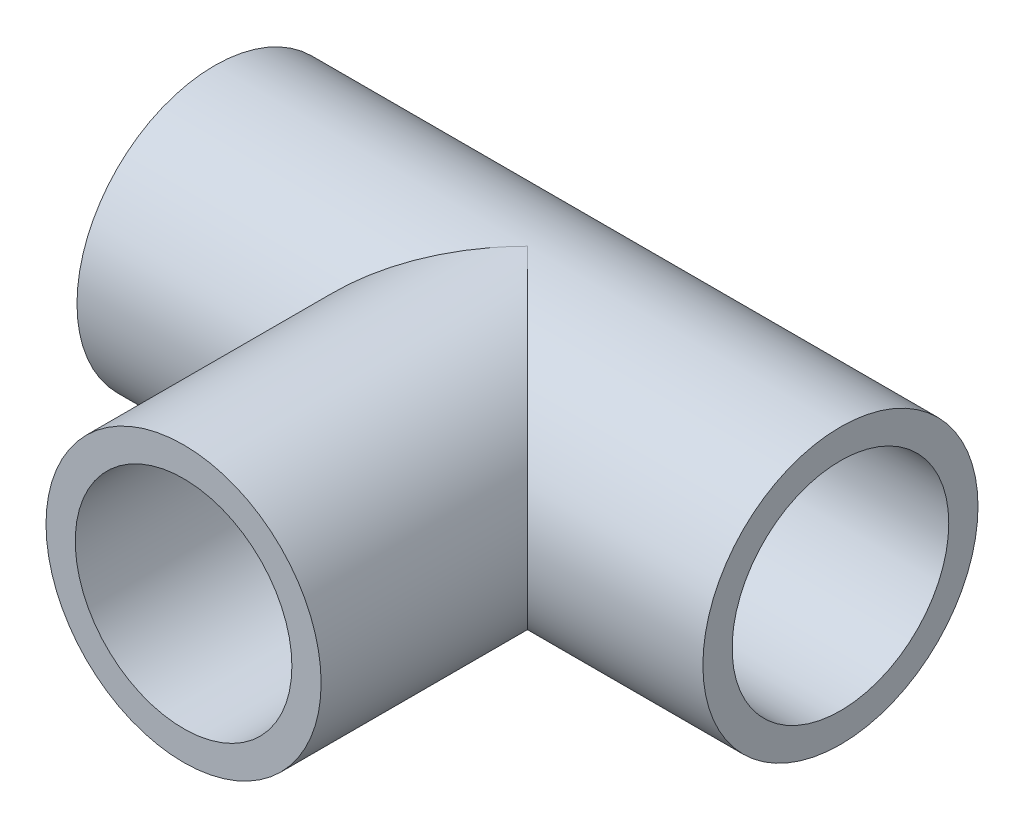
from build123d import *
from build123d.topology import SkipClean

# Parameters (mm, degrees)
SKETCH1_R               = 10.16
SKETCH1_R_2             = 6.35
BOSS_EXTRUDE2_DEPTH     = 20.828
SKETCH8_R               = 10.16
SKETCH8_R_2             = 6.35
BOSS_EXTRUDE5_DEPTH     = 12.7
BOSS_EXTRUDE6_START     = 12.7
SKETCH2_R               = 10.16
SKETCH2_R_2             = 8.001
BOSS_EXTRUDE6_DEPTH     = 12.7
SKETCH3_R               = 10.16
SKETCH3_R_2             = 8.001
BOSS_EXTRUDE7_DEPTH     = 12.7
SKETCH9_R               = 10.16
SKETCH9_R_2             = 8.001
BOSS_EXTRUDE8_DEPTH     = 12.7
CUT_EXTRUDE1_DEPTH      = 15.24
CUT_EXTRUDE1_DEPTH_BACK = 0.0001
SKETCH10_R              = 6.280987547
CUT_EXTRUDE2_DEPTH      = 25.4
CUT_EXTRUDE2_DEPTH_BACK = 0.0001
SKETCH11_R              = 6.35


with BuildPart() as part:
    # Sketch1 → Boss-Extrude2 (new body)
    with BuildSketch(Plane(origin=(0, 0, 0), x_dir=(0, 0, -1), z_dir=(1, 0, 0))):
        Circle(SKETCH1_R)
        Circle(SKETCH1_R_2, mode=Mode.SUBTRACT)
    extrude(amount=BOSS_EXTRUDE2_DEPTH)

    # Sketch8 → Boss-Extrude5 (add)
    with BuildSketch(Plane.XY):
        with Locations((10.410594778, 0)):
            Circle(SKETCH8_R)
        with Locations((10.410594778, 0)):
            Circle(SKETCH8_R_2, mode=Mode.SUBTRACT)
    extrude(amount=BOSS_EXTRUDE5_DEPTH)

    # Sketch2 → Boss-Extrude6 (add)
    with BuildSketch(Plane.ZY.offset(BOSS_EXTRUDE6_START)):
        Circle(SKETCH2_R)
        Circle(SKETCH2_R_2, mode=Mode.SUBTRACT)
    extrude(amount=-BOSS_EXTRUDE6_DEPTH)

    # Sketch3 → Boss-Extrude7 (add)
    with SkipClean():  # the faces are left unmerged after this step: merging them gives an invalid solid
        with BuildSketch(Plane(origin=(20.828, 0, 0), x_dir=(0, 0, -1), z_dir=(1, 0, 0))):
            Circle(SKETCH3_R)
            Circle(SKETCH3_R_2, mode=Mode.SUBTRACT)
        extrude(amount=BOSS_EXTRUDE7_DEPTH)

    # Sketch9 → Boss-Extrude8 (add)
    with SkipClean():  # the faces are left unmerged after this step: merging them gives an invalid solid
        with BuildSketch(Plane.XY.offset(12.7)):
            with Locations((10.410594778, 0)):
                Circle(SKETCH9_R)
            with Locations((10.410594778, 0)):
                Circle(SKETCH9_R_2, mode=Mode.SUBTRACT)
        extrude(amount=BOSS_EXTRUDE8_DEPTH)

    # Sketch10 → Cut-Extrude1 (cut, two sides: drawn at the far end of the back side and taken through both)
    with SkipClean():  # the faces are left unmerged after this step: merging them gives an invalid solid
        with BuildSketch(Plane.XY.offset(-CUT_EXTRUDE1_DEPTH_BACK)):
            with Locations((10.410594778, 0)):
                Circle(SKETCH10_R)
        extrude(amount=CUT_EXTRUDE1_DEPTH + CUT_EXTRUDE1_DEPTH_BACK, mode=Mode.SUBTRACT)

    # Sketch11 → Cut-Extrude2 (cut, two sides: drawn at the far end of the back side and taken through both)
    with SkipClean():  # the faces are left unmerged after this step: merging them gives an invalid solid
        with BuildSketch(Plane(origin=(0, 0, 0), x_dir=(0, 0, -1), z_dir=(1, 0, 0)).offset(-CUT_EXTRUDE2_DEPTH_BACK)):
            Circle(SKETCH11_R)
        extrude(amount=CUT_EXTRUDE2_DEPTH + CUT_EXTRUDE2_DEPTH_BACK, mode=Mode.SUBTRACT)


solid = part.part
